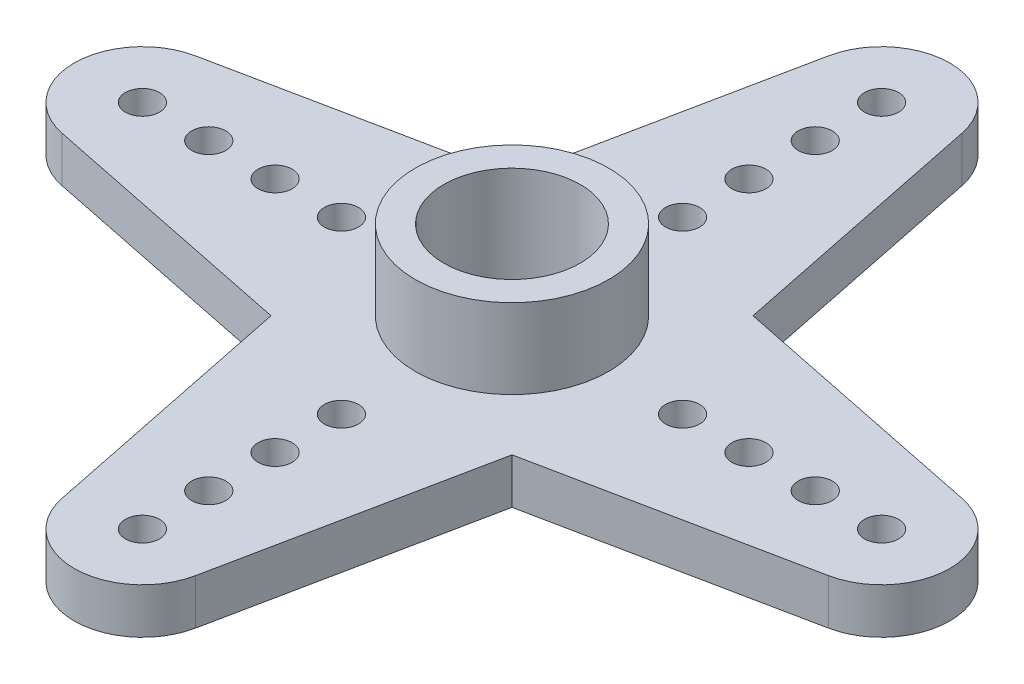
from build123d import *

# Parameters (mm, degrees)
SKETCH_1_R      = 0.75
SKETCH_1_R_2    = 4.25
EXTRUDE_1_DEPTH = 2
SKETCH_1_3_R    = 3
SKETCH_1_3_R_2  = 1.5
EXTRUDE_2_DEPTH = 1
SKETCH_1_4_R    = 4.25
SKETCH_1_4_R_2  = 3
EXTRUDE_3_DEPTH = 5.5


with BuildPart() as part:
    # Эскиз1 → Бобышка-Вытянуть1 (new body)
    with BuildSketch(Plane(origin=(0, 0, 0), x_dir=(1, 0, 0), z_dir=(0, 1, 0))):
        with BuildLine():
            ThreePointArc((-16.85, 2.939387691), (-19.25, 0), (-16.85, -2.939387691))
            Line((-16.85, -2.939387691), (-5.297526475, -5.297526475))
            Line((-5.297526475, -5.297526475), (-2.939387691, -16.85))
            ThreePointArc((-2.939387691, -16.85), (0, -19.25), (2.939387691, -16.85))
            Line((2.939387691, -16.85), (5.297526475, -5.297526475))
            Line((5.297526475, -5.297526475), (16.85, -2.939387691))
            ThreePointArc((16.85, -2.939387691), (19.25, 0), (16.85, 2.939387691))
            Line((16.85, 2.939387691), (5.297526475, 5.297526475))
            Line((5.297526475, 5.297526475), (2.939387691, 16.85))
            ThreePointArc((2.939387691, 16.85), (0, 19.25), (-2.939387691, 16.85))
            Line((-2.939387691, 16.85), (-5.297526475, 5.297526475))
            Line((-5.297526475, 5.297526475), (-16.85, 2.939387691))
        make_face()
        with BuildLine():
            ThreePointArc((-14.083333333, 0), (-13.333333333, 0.75), (-12.583333333, 0))
            ThreePointArc((-12.583333333, 0), (-13.333333333, -0.75), (-14.083333333, 0))
        make_face(mode=Mode.SUBTRACT)
        with Locations((-16.25, 0)):
            Circle(SKETCH_1_R, mode=Mode.SUBTRACT)
        with BuildLine():
            ThreePointArc((-9.666666667, 0), (-10.416666667, -0.75), (-11.166666667, 0))
            ThreePointArc((-11.166666667, 0), (-10.416666667, 0.75), (-9.666666667, 0))
        make_face(mode=Mode.SUBTRACT)
        with Locations((-7.5, 0)):
            Circle(SKETCH_1_R, mode=Mode.SUBTRACT)
        Circle(SKETCH_1_R_2, mode=Mode.SUBTRACT)
        with BuildLine():
            ThreePointArc((0, 12.583333333), (-0.75, 13.333333333), (0, 14.083333333))
            ThreePointArc((0, 14.083333333), (0.75, 13.333333333), (0, 12.583333333))
        make_face(mode=Mode.SUBTRACT)
        with Locations((0, 7.5)):
            Circle(SKETCH_1_R, mode=Mode.SUBTRACT)
        with BuildLine():
            ThreePointArc((0, 9.666666667), (-0.75, 10.416666667), (0, 11.166666667))
            ThreePointArc((0, 11.166666667), (0.75, 10.416666667), (0, 9.666666667))
        make_face(mode=Mode.SUBTRACT)
        with Locations((13.333333333, 0)):
            Circle(SKETCH_1_R, mode=Mode.SUBTRACT)
        with Locations((7.5, 0)):
            Circle(SKETCH_1_R, mode=Mode.SUBTRACT)
        with Locations((10.416666667, 0)):
            Circle(SKETCH_1_R, mode=Mode.SUBTRACT)
        with Locations((0, -10.416666667)):
            Circle(SKETCH_1_R, mode=Mode.SUBTRACT)
        with Locations((0, -7.5)):
            Circle(SKETCH_1_R, mode=Mode.SUBTRACT)
        with Locations((0, -13.333333333)):
            Circle(SKETCH_1_R, mode=Mode.SUBTRACT)
        with Locations((0, 16.25)):
            Circle(SKETCH_1_R, mode=Mode.SUBTRACT)
        with Locations((16.25, 0)):
            Circle(SKETCH_1_R, mode=Mode.SUBTRACT)
        with Locations((0, -16.25)):
            Circle(SKETCH_1_R, mode=Mode.SUBTRACT)
    extrude(amount=EXTRUDE_1_DEPTH)



with BuildPart() as body_2:
    # Эскиз1<3> → Бобышка-Вытянуть2 (new body)
    with BuildSketch(Plane(origin=(0, 0, 0), x_dir=(1, 0, 0), z_dir=(0, 1, 0))):
        Circle(SKETCH_1_3_R)
        Circle(SKETCH_1_3_R_2, mode=Mode.SUBTRACT)
    extrude(amount=EXTRUDE_2_DEPTH)


with BuildPart() as part_1:
    add(part.part)

    add(body_2.part)  # Бобышка-Вытянуть3 merges body 2
    # Эскиз1<4> → Бобышка-Вытянуть3 (add)
    with BuildSketch(Plane(origin=(0, 0, 0), x_dir=(1, 0, 0), z_dir=(0, 1, 0))):
        Circle(SKETCH_1_4_R)
        Circle(SKETCH_1_4_R_2, mode=Mode.SUBTRACT)
    extrude(amount=EXTRUDE_3_DEPTH)


solid = part_1.part
